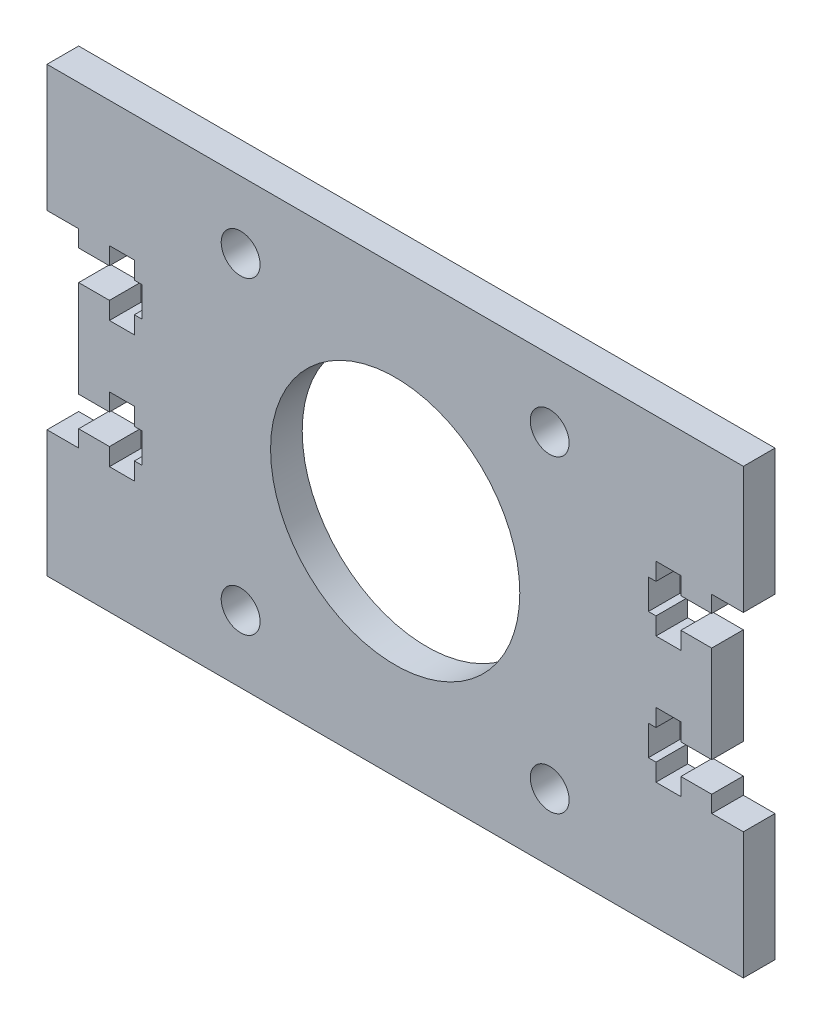
from build123d import *

# Parameters (mm, degrees)
SKETCH2_R           = 1.95
SKETCH2_R_2         = 12.5
BOSS_EXTRUDE1_DEPTH = 3.175


with BuildPart() as part:
    # Sketch2 → Boss-Extrude1 (new body)
    with BuildSketch(Plane.XY):
        Polygon((-3.175, 0), (66.675, 0), (66.675, 12.7), (63.5, 12.7), (63.5, 14.375), (60.412, 14.375), (60.412, 12.625), (57.912, 12.625), (57.912, 14.375), (57.15, 14.375), (57.15, 17.375), (57.912, 17.375), (57.912, 19.125), (60.412, 19.125), (60.412, 17.375), (63.5, 17.375), (63.5, 27.075), (60.412, 27.075), (60.412, 25.325), (57.912, 25.325), (57.912, 27.075), (57.15, 27.075), (57.15, 30.075), (57.912, 30.075), (57.912, 31.825), (60.412, 31.825), (60.412, 30.075), (63.5, 30.075), (63.5, 31.75), (66.675, 31.75), (66.675, 44.45), (-3.175, 44.45), (-3.175, 31.75), (0, 31.75), (0, 30.075), (3.088, 30.075), (3.088, 31.825), (5.588, 31.825), (5.588, 30.075), (6.35, 30.075), (6.35, 27.075), (5.588, 27.075), (5.588, 25.325), (3.088, 25.325), (3.088, 27.075), (0, 27.075), (0, 17.375), (3.088, 17.375), (3.088, 19.125), (5.588, 19.125), (5.588, 17.375), (6.35, 17.375), (6.35, 14.375), (5.588, 14.375), (5.588, 12.625), (3.088, 12.625), (3.088, 14.375), (0, 14.375), (0, 12.7), (-3.175, 12.7), align=None)
        with Locations((16.25, 6.725)):
            Circle(SKETCH2_R, mode=Mode.SUBTRACT)
        with Locations((47.25, 6.725)):
            Circle(SKETCH2_R, mode=Mode.SUBTRACT)
        with Locations((16.25, 37.725)):
            Circle(SKETCH2_R, mode=Mode.SUBTRACT)
        with Locations((31.75, 22.225)):
            Circle(SKETCH2_R_2, mode=Mode.SUBTRACT)
        with Locations((47.25, 37.725)):
            Circle(SKETCH2_R, mode=Mode.SUBTRACT)
    extrude(amount=BOSS_EXTRUDE1_DEPTH)


solid = part.part
